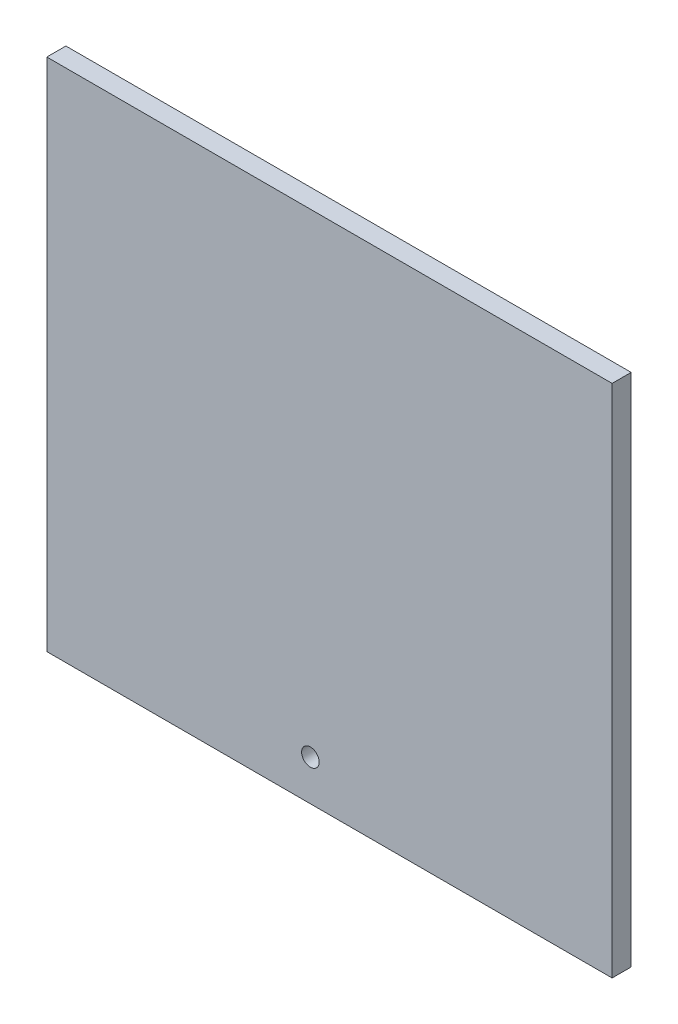
from build123d import *

# Parameters (mm, degrees)
SKETCH1_W           = 188.214
SKETCH1_H           = 171.45
BOSS_EXTRUDE1_DEPTH = 6.35
SKETCH2_R           = 2.921
CUT_EXTRUDE1_DEPTH  = 128.456759625


with BuildPart() as part:
    # Sketch1 → Boss-Extrude1 (new body)
    with BuildSketch(Plane.XY):
        Rectangle(SKETCH1_W, SKETCH1_H)
    extrude(amount=BOSS_EXTRUDE1_DEPTH)

    # Sketch2 → Cut-Extrude1 (cut, through all)
    with BuildSketch(Plane.XY.offset(6.35)):
        with Locations((-6.35, -72.263)):
            Circle(SKETCH2_R)
    extrude(amount=-CUT_EXTRUDE1_DEPTH, mode=Mode.SUBTRACT)


solid = part.part
